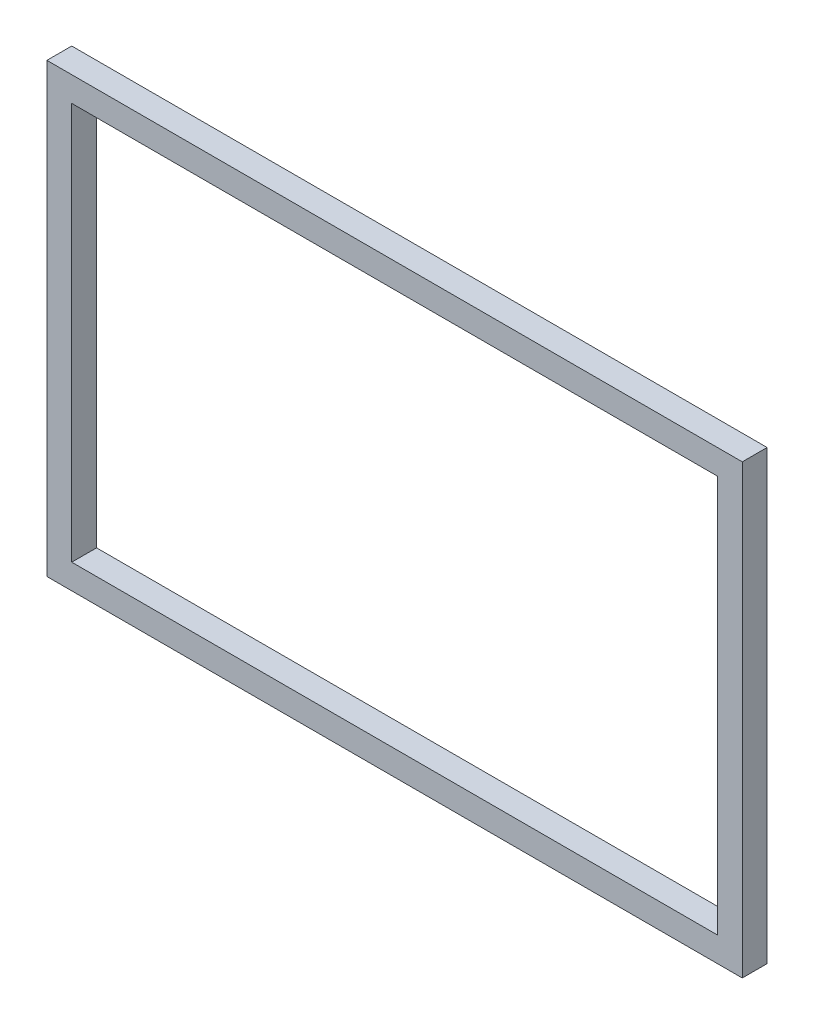
from build123d import *

# Parameters (mm, degrees)
SKETCH1_W           = 280
SKETCH1_H           = 180
SKETCH1_W_2         = 260
SKETCH1_H_2         = 160
EXTRUDE_THIN1_DEPTH = 10


with BuildPart() as part:
    # Sketch1 → Extrude-Thin1 (new body)
    with BuildSketch(Plane.XY):
        with Locations((92.555501679, -63.225765568)):
            Rectangle(SKETCH1_W, SKETCH1_H)
        with Locations((92.555501679, -63.225765568)):
            Rectangle(SKETCH1_W_2, SKETCH1_H_2, mode=Mode.SUBTRACT)
    extrude(amount=EXTRUDE_THIN1_DEPTH)


solid = part.part
